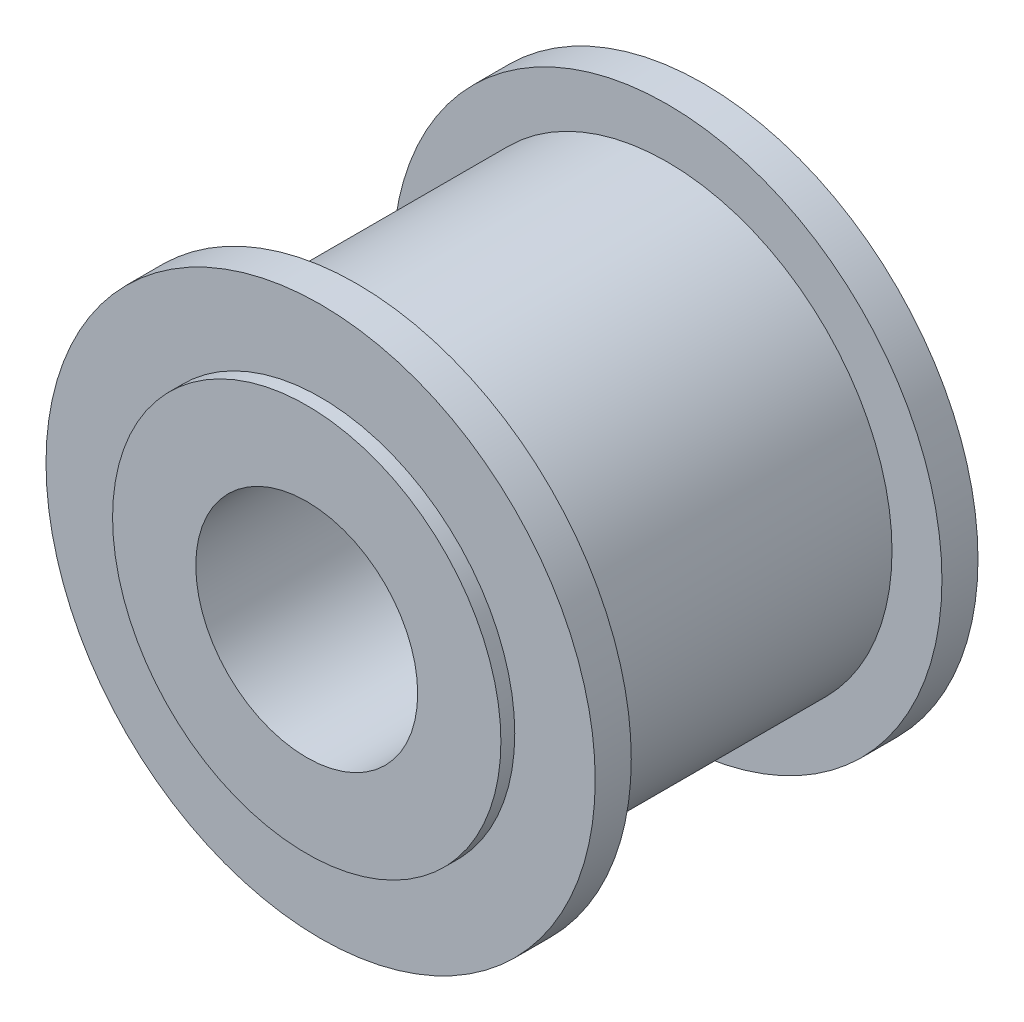
from build123d import *

# Parameters (mm, degrees)
SKETCH1_R           = 7
BOSS_EXTRUDE1_DEPTH = 0.5
SKETCH2_R           = 9.9
BOSS_EXTRUDE2_DEPTH = 1.3
SKETCH3_R           = 8.1
BOSS_EXTRUDE3_DEPTH = 11.2
SKETCH4_R           = 9.9
BOSS_EXTRUDE4_DEPTH = 1.3
SKETCH5_R           = 7
BOSS_EXTRUDE5_DEPTH = 0.5
SKETCH6_R           = 4
CUT_EXTRUDE1_DEPTH  = 21.373021376


with BuildPart() as part:
    # Sketch1 → Boss-Extrude1 (new body)
    with BuildSketch(Plane.XY):
        Circle(SKETCH1_R)
    extrude(amount=BOSS_EXTRUDE1_DEPTH)

    # Sketch2 → Boss-Extrude2 (add)
    with BuildSketch(Plane.XY.offset(0.5)):
        Circle(SKETCH2_R)
    extrude(amount=BOSS_EXTRUDE2_DEPTH)

    # Sketch3 → Boss-Extrude3 (add)
    with BuildSketch(Plane.XY.offset(1.8)):
        Circle(SKETCH3_R)
    extrude(amount=BOSS_EXTRUDE3_DEPTH)

    # Sketch4 → Boss-Extrude4 (add)
    with BuildSketch(Plane.XY.offset(13)):
        Circle(SKETCH4_R)
    extrude(amount=BOSS_EXTRUDE4_DEPTH)

    # Sketch5 → Boss-Extrude5 (add)
    with BuildSketch(Plane.XY.offset(14.3)):
        Circle(SKETCH5_R)
    extrude(amount=BOSS_EXTRUDE5_DEPTH)

    # Sketch6 → Cut-Extrude1 (cut, through all)
    with BuildSketch(Plane.XY.offset(14.8)):
        Circle(SKETCH6_R)
    extrude(amount=-CUT_EXTRUDE1_DEPTH, mode=Mode.SUBTRACT)


solid = part.part
